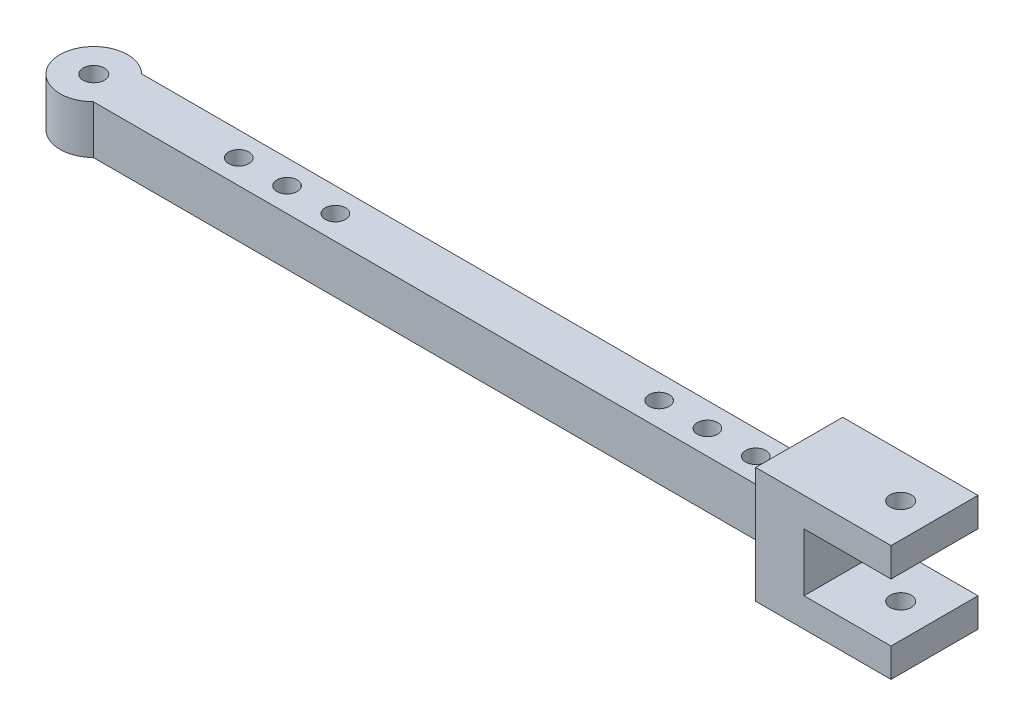
from build123d import *

# Parameters (mm, degrees)
SKETCH1_W           = 80
SKETCH1_H           = 5
BOSS_EXTRUDE1_DEPTH = 5
BOSS_EXTRUDE4_START = 3.5
SKETCH7_W           = 14
SKETCH7_H           = 9
BOSS_EXTRUDE4_DEPTH = 12
CUT_EXTRUDE5_START  = -3
SKETCH9_W           = 9
SKETCH9_H           = 9
CUT_EXTRUDE5_DEPTH  = 6
SKETCH11_R          = 1.1
CUT_EXTRUDE6_DEPTH  = 12
SKETCH16_R          = 3.5
BOSS_EXTRUDE7_DEPTH = 5
SKETCH15_R          = 1.1
CUT_EXTRUDE9_DEPTH  = 5
SKETCH17_R          = 1.05
CUT_EXTRUDE10_DEPTH = 5


with BuildPart() as part:
    # Sketch1 → Boss-Extrude1 (new body)
    with BuildSketch(Plane(origin=(0, 0, 0), x_dir=(1, 0, 0), z_dir=(0, 1, 0))):
        Rectangle(SKETCH1_W, SKETCH1_H)
    extrude(amount=BOSS_EXTRUDE1_DEPTH)

    # Sketch7 → Boss-Extrude4 (add)
    with BuildSketch(Plane(origin=(0, 5, 0), x_dir=(1, 0, 0), z_dir=(0, 1, 0)).offset(BOSS_EXTRUDE4_START)):
        with Locations((40, 0)):
            Rectangle(SKETCH7_W, SKETCH7_H)
    extrude(amount=-BOSS_EXTRUDE4_DEPTH)

    # Sketch9 → Cut-Extrude5 (cut)
    with BuildSketch(Plane(origin=(0, 8.5, 0), x_dir=(1, 0, 0), z_dir=(0, 1, 0)).offset(CUT_EXTRUDE5_START)):
        with Locations((42.5, 0)):
            Rectangle(SKETCH9_W, SKETCH9_H)
    extrude(amount=-CUT_EXTRUDE5_DEPTH, mode=Mode.SUBTRACT)

    # Sketch11 → Cut-Extrude6 (cut)
    with BuildSketch(Plane(origin=(0, 8.5, 0), x_dir=(1, 0, 0), z_dir=(0, 1, 0))):
        with Locations(Location((43.5, 0, 0), (0, 0, 270))):
            Circle(SKETCH11_R)
    extrude(amount=-CUT_EXTRUDE6_DEPTH, mode=Mode.SUBTRACT)

    # Sketch16 → Boss-Extrude7 (add)
    with BuildSketch(Plane(origin=(0, 5, 0), x_dir=(1, 0, 0), z_dir=(0, 1, 0))):
        with Locations((-40, 0)):
            Circle(SKETCH16_R)
    extrude(amount=-BOSS_EXTRUDE7_DEPTH)

    # Sketch15 → Cut-Extrude9 (cut)
    with BuildSketch(Plane(origin=(0, 5, 0), x_dir=(1, 0, 0), z_dir=(0, 1, 0))):
        with Locations(Location((-40, 0, 0), (0, 0, 270))):
            Circle(SKETCH15_R)
    extrude(amount=-CUT_EXTRUDE9_DEPTH, mode=Mode.SUBTRACT)

    # Sketch17 → Cut-Extrude10 (cut)
    with BuildSketch(Plane.XZ):
        with Locations(Location((-20, 0, 0), (0, 0, 270))):
            Circle(SKETCH17_R)
        with Locations(Location((23.5, 0, 0), (0, 0, 270))):
            Circle(SKETCH17_R)
        with Locations(Location((-25, 0, 0), (0, 0, 270))):
            Circle(SKETCH17_R)
        with Locations(Location((-15, 0, 0), (0, 0, 270))):
            Circle(SKETCH17_R)
        with Locations(Location((18.5, 0, 0), (0, 0, 270))):
            Circle(SKETCH17_R)
        with Locations(Location((28.5, 0, 0), (0, 0, 270))):
            Circle(SKETCH17_R)
    extrude(amount=-CUT_EXTRUDE10_DEPTH, mode=Mode.SUBTRACT)


solid = part.part
